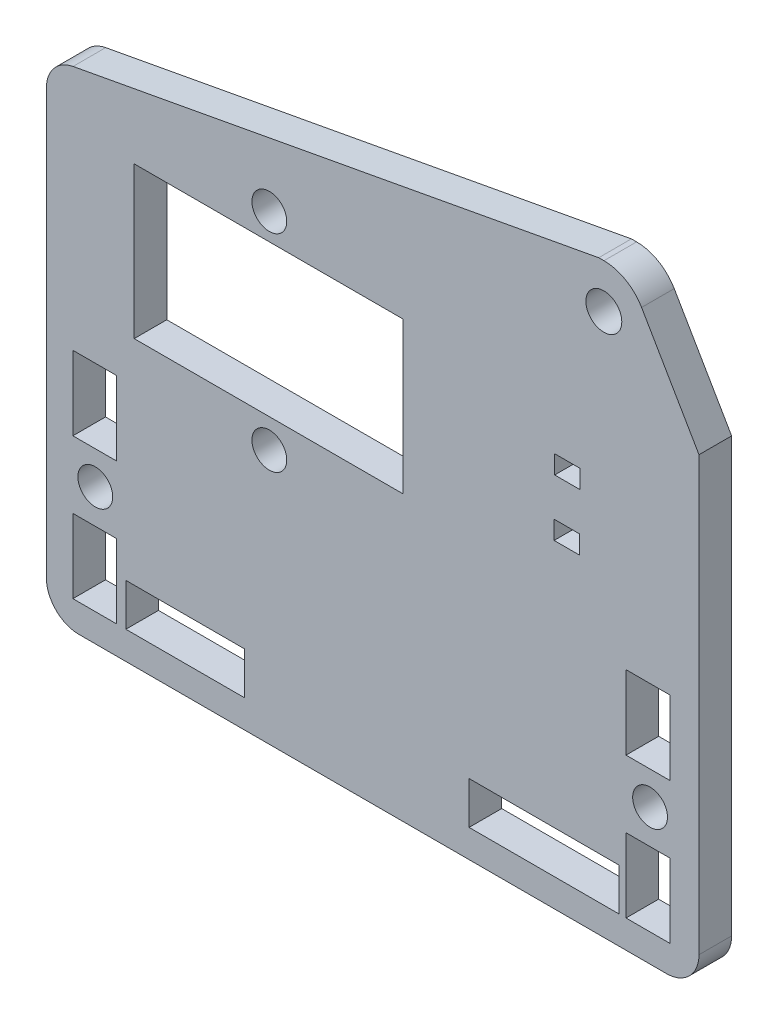
from build123d import *

# Parameters (mm, degrees)
SKETCH_1_R          = 1.358928477
SKETCH_1_R_2        = 1.599915794
SKETCH_1_R_3        = 1.649913162
SKETCH_1_W          = 3.996376927
SKETCH_1_H          = 6.806421868
SKETCH_1_H_2        = 6.790704991
SKETCH_1_W_2        = 4.032106697
SKETCH_1_W_3        = 10.92790885
SKETCH_1_H_3        = 3.891970495
SKETCH_1_W_4        = 13.80275679
SKETCH_1_W_5        = 2.328877428
SKETCH_1_H_4        = 1.692910899
SKETCH_1_W_6        = 2.328877427
SKETCH_1_H_5        = 1.6929109
SKETCH_1_W_7        = 24.700449722
SKETCH_1_H_6        = 13.915746322
EXTRUDE_1_DEPTH     = 3
SKETCH_2_R          = 1.6
CUT_EXTRUDE_1_DEPTH = 67.261211836


with BuildPart() as part:
    # 草图1 → 凸台-拉伸1 (new body)
    with BuildSketch(Plane(origin=(0, 0, 0), x_dir=(-1, 0, 0), z_dir=(0, 0, -1))):
        with BuildLine():
            Line((-56.997000158, -27.962959634), (-2.999842114, -27.962959634))
            ThreePointArc((-2.999842114, -27.962959634), (-0.878633413, -27.084326221), (0, -24.96311752))
            Line((0, -24.96311752), (0, 14.034849413))
            ThreePointArc((0, 14.034849413), (-0.693847958, 15.953558265), (-2.454424946, 16.984692259))
            Line((-2.454424946, 16.984692259), (-50.77996637, 25.919941108))
            Line((-50.77996637, 25.919941108), (-51.260080297, 25.919941108))
            ThreePointArc((-51.260080297, 25.919941108), (-53.255311763, 25.386759089), (-54.718604462, 23.929362046))
            Line((-54.718604462, 23.929362046), (-59.996842271, 14.843746718))
            Line((-59.996842271, 14.843746718), (-59.996842271, -24.96311752))
            ThreePointArc((-59.996842271, -24.96311752), (-59.118208859, -27.084326221), (-56.997000158, -27.962959634))
        make_face()
        with Locations(Location((-55.497079101, -15.463517499, 0), (0, 0, 180))):
            Circle(SKETCH_1_R, mode=Mode.SUBTRACT)
        with Locations(Location((-4.49976317, -15.463517499, 0), (0, 0, 180))):
            Circle(SKETCH_1_R, mode=Mode.SUBTRACT)
        with Locations(Location((-20.497921162, -4.53509268, 0), (0, 0, 180))):
            Circle(SKETCH_1_R_2, mode=Mode.SUBTRACT)
        with Locations(Location((-20.497921162, 14.46490732, 0), (0, 0, 180))):
            Circle(SKETCH_1_R_2, mode=Mode.SUBTRACT)
        with Locations(Location((-51.248302721, 21.868517657, 0), (0, 0, 180))):
            Circle(SKETCH_1_R_3, mode=Mode.SUBTRACT)
        with Locations((-4.436721131, -9.025383771)):
            Rectangle(SKETCH_1_W, SKETCH_1_H, mode=Mode.SUBTRACT)
        with Locations((-4.436721131, -22.000344001)):
            Rectangle(SKETCH_1_W, SKETCH_1_H_2, mode=Mode.SUBTRACT)
        with Locations((-55.302485972, -22.000344001)):
            Rectangle(SKETCH_1_W_2, SKETCH_1_H_2, mode=Mode.SUBTRACT)
        with Locations((-55.302485972, -9.025383771)):
            Rectangle(SKETCH_1_W_2, SKETCH_1_H, mode=Mode.SUBTRACT)
        with Locations((-12.771799921, -23.449711249)):
            Rectangle(SKETCH_1_W_3, SKETCH_1_H_3, mode=Mode.SUBTRACT)
        with Locations((-45.760922572, -23.449711249)):
            Rectangle(SKETCH_1_W_4, SKETCH_1_H_3, mode=Mode.SUBTRACT)
        with Locations((-47.892979317, 7.443776854)):
            Rectangle(SKETCH_1_W_5, SKETCH_1_H_4, mode=Mode.SUBTRACT)
        with Locations((-47.840982053, 2.205052576)):
            Rectangle(SKETCH_1_W_6, SKETCH_1_H_5, mode=Mode.SUBTRACT)
        with Locations((-20.421644705, 5.082457397)):
            Rectangle(SKETCH_1_W_7, SKETCH_1_H_6, mode=Mode.SUBTRACT)
    extrude(amount=-EXTRUDE_1_DEPTH)

    # 草图2 → 切除-拉伸1 (cut, through all)
    with BuildSketch(Plane.XY.offset(3)):
        with Locations((55.497079101, -15.463517499)):
            Circle(SKETCH_2_R)
        with Locations((4.49976317, -15.463517499)):
            Circle(SKETCH_2_R)
    extrude(amount=-CUT_EXTRUDE_1_DEPTH, mode=Mode.SUBTRACT)


solid = part.part
